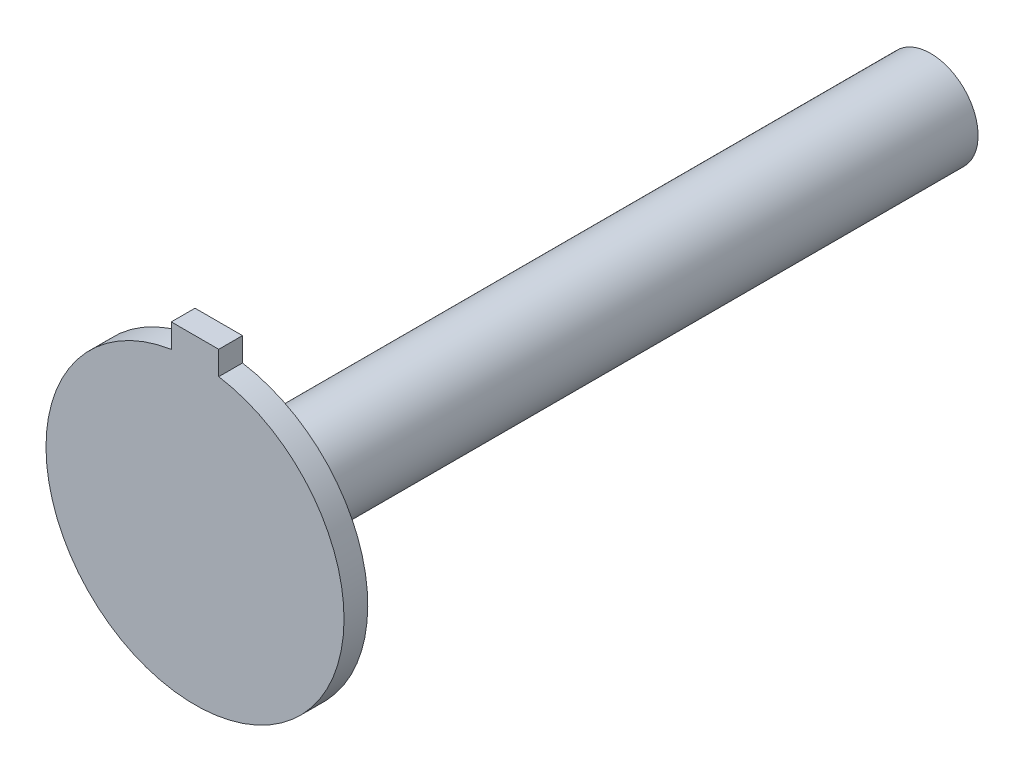
from build123d import *

# Parameters (mm, degrees)
BASE_EXTRUSION_DEPTH = 5
ESQUISSE2_R          = 10
BOSS_EXTRU_1_DEPTH   = 150


with BuildPart() as part:
    # Esquisse1 → Base-Extrusion (new body)
    with BuildSketch(Plane.XY):
        with BuildLine():
            Line((-5, 30.999354832), (-5, 35.999354832))
            Line((-5, 35.999354832), (5, 35.999354832))
            Line((5, 35.999354832), (5, 30.999354832))
            ThreePointArc((5, 30.999354832), (0, -31.4), (-5, 30.999354832))
        make_face()
    extrude(amount=BASE_EXTRUSION_DEPTH)

    # Esquisse2 → Boss.-Extru.1 (add)
    with BuildSketch(Plane(origin=(0, 0, 0), x_dir=(-1, 0, 0), z_dir=(0, 0, -1))):
        Circle(ESQUISSE2_R)
    extrude(amount=BOSS_EXTRU_1_DEPTH)


solid = part.part
